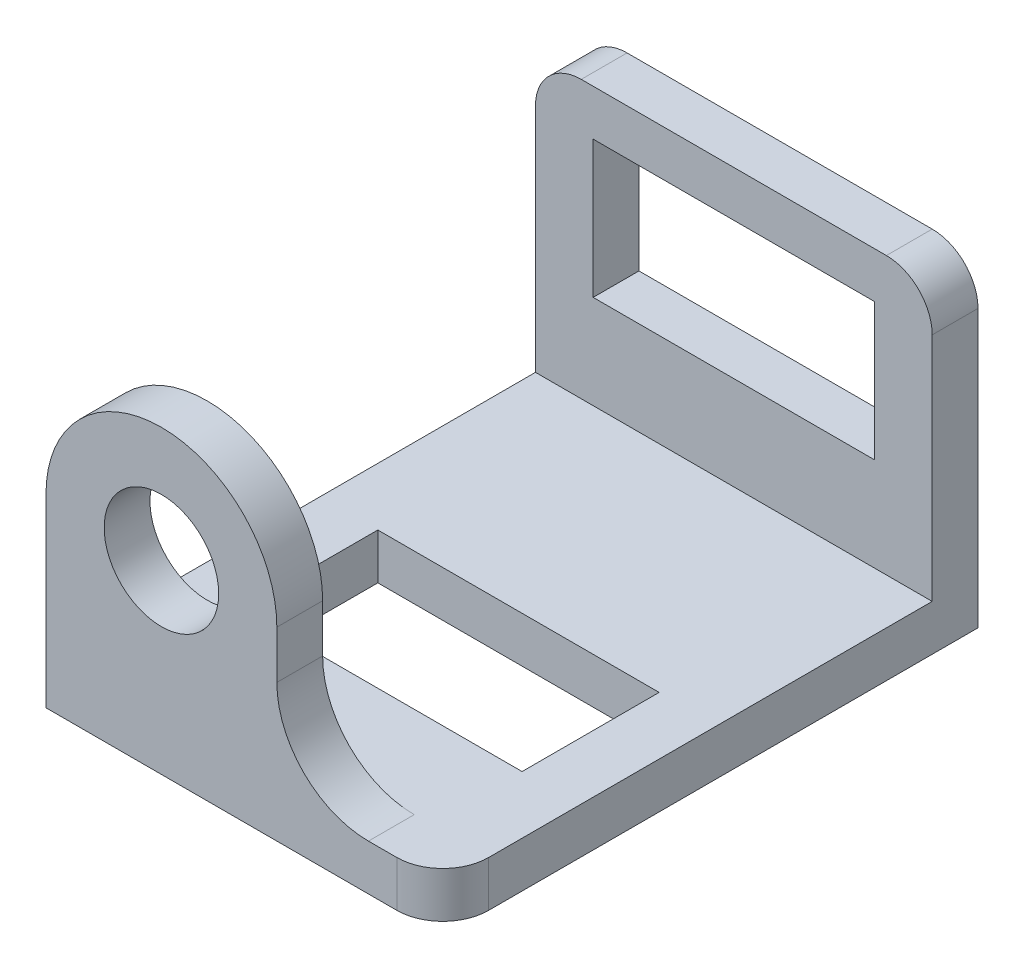
from build123d import *

# Parameters (mm, degrees)
SKETCH1_W            = 55
SKETCH1_H            = 74.202
SKETCH1_W_2          = 39
SKETCH1_H_2          = 19
BOSS_EXTRUDE1_DEPTH  = 6.35
SKETCH2_W            = 55
SKETCH2_H            = 38.35
SKETCH2_W_2          = 39
SKETCH2_H_2          = 19
BOSS_EXTRUDE2_DEPTH  = 6.35
SKETCH12_R           = 7.9375
BOSS_EXTRUDE11_DEPTH = 6.35
FILLET2_R            = 12.7
FILLET1_R            = 6.35


with BuildPart() as part:
    # Sketch1 → Boss-Extrude1 (new body)
    with BuildSketch(Plane(origin=(0, 0, 0), x_dir=(1, 0, 0), z_dir=(0, 1, 0))):
        with Locations((0, 8.601)):
            Rectangle(SKETCH1_W, SKETCH1_H)
        Rectangle(SKETCH1_W_2, SKETCH1_H_2, mode=Mode.SUBTRACT)
    extrude(amount=BOSS_EXTRUDE1_DEPTH)

    # Sketch2 → Boss-Extrude2 (add)
    with BuildSketch(Plane.XY.offset(-45.702)):
        with Locations((0, 25.525)):
            Rectangle(SKETCH2_W, SKETCH2_H)
        with Locations((0, 28.85)):
            Rectangle(SKETCH2_W_2, SKETCH2_H_2, mode=Mode.SUBTRACT)
    extrude(amount=BOSS_EXTRUDE2_DEPTH)

    # Sketch12 → Boss-Extrude11 (add)
    with BuildSketch(Plane.XY.offset(28.5)):
        with BuildLine():
            Line((-27.5, 25.68), (-27.5, 6.35))
            Line((-27.5, 6.35), (4.5, 6.35))
            Line((4.5, 6.35), (4.5, 25.68))
            ThreePointArc((4.5, 25.68), (-11.5, 41.68), (-27.5, 25.68))
        make_face()
        with Locations((-11.5, 25.68)):
            Circle(SKETCH12_R, mode=Mode.SUBTRACT)
    extrude(amount=-BOSS_EXTRUDE11_DEPTH)

    # Fillet2
    fillet2_edges = [part.edges().sort_by_distance(p)[0] for p in [
        (4.5, 6.35, 25.325),
    ]]
    fillet(fillet2_edges, radius=FILLET2_R)

    # Fillet1
    fillet1_edges = [part.edges().sort_by_distance(p)[0] for p in [
        (27.5, 44.7, -42.527),
        (-27.5, 44.7, -42.527),
        (27.5, 3.175, 28.5),
    ]]
    fillet(fillet1_edges, radius=FILLET1_R)


solid = part.part
